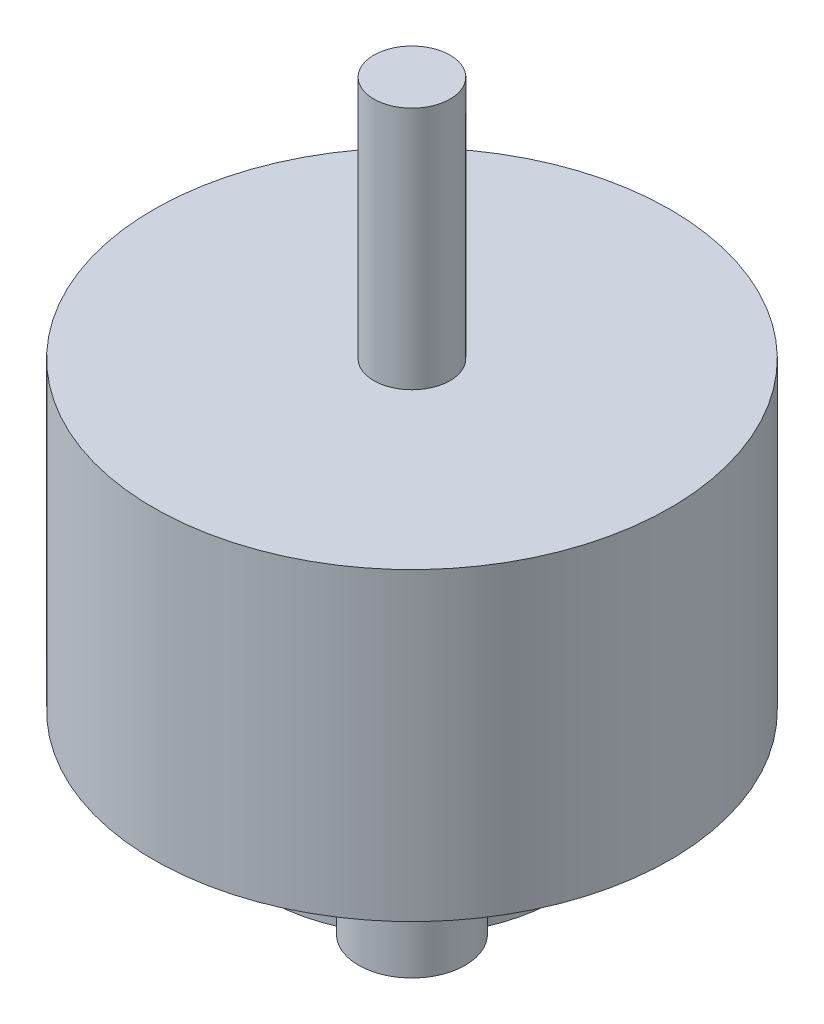
from build123d import *

# Parameters (mm, degrees)
ESQUISSE2_R          = 3.5
BOSS_EXTRU_1_DEPTH   = 3.5
D_GAGEMENT_M31_D     = 3.4
D_GAGEMENT_M31_DEPTH = 3.5


with BuildPart() as part:
    # Esquisse1 → Révolution1 (revolve)
    with BuildSketch(Plane.XY, mode=Mode.PRIVATE) as r_volution1_sk:
        Polygon((0, 0), (-9.5, 0), (-9.5, 3.5), (-7.5, 3.5), (-6.95, 6), (-16.95, 6), (-16.95, 26), (-2.5, 26), (-2.5, 42), (0, 42), align=None)
    revolve(r_volution1_sk.sketch.rotate(Axis((0, 0, 0), (0, 1, 0)), 270), axis=Axis((0, 0, 0), (0, 1, 0)))

    # Esquisse2 → Boss.-Extru.1 (add)
    with BuildSketch(Plane(origin=(0, 0, 0), x_dir=(-1, 0, 0), z_dir=(0, -1, 0))):
        with Locations((6.717514421, -6.717514421)):
            Circle(ESQUISSE2_R)
        with Locations((-6.717514421, -6.717514421)):
            Circle(ESQUISSE2_R)
        with Locations((-6.717514421, 6.717514421)):
            Circle(ESQUISSE2_R)
        with Locations((6.717514421, 6.717514421)):
            Circle(ESQUISSE2_R)
    extrude(amount=-BOSS_EXTRU_1_DEPTH)

    # Dégagement M31
    with Locations(Plane(origin=(-6.717514421, 0, 6.717514421), x_dir=(0, 0, -1), z_dir=(0, -1, 0))):
        with Locations((0, 0), (0, 13.435028842), (13.435028842, 13.435028842), (13.435028842, 0)):
            Hole(D_GAGEMENT_M31_D / 2, depth=D_GAGEMENT_M31_DEPTH)


solid = part.part
